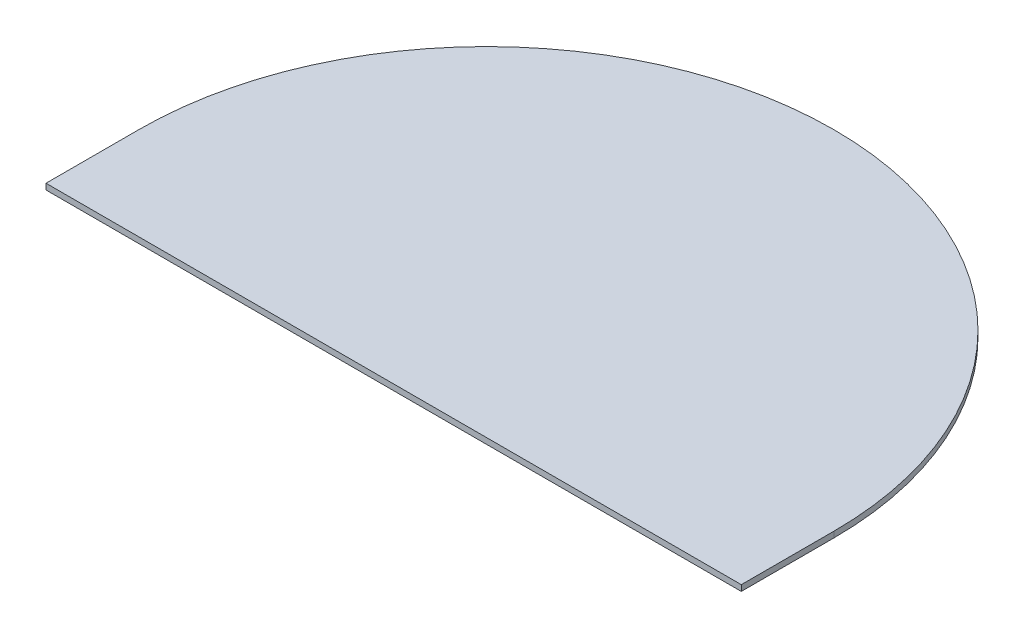
from build123d import *

# Parameters (mm, degrees)
BOSS_EXTRU_3_DEPTH = 6.35


with BuildPart() as part:
    # Esquisse2 → Boss.-Extru.3 (new body)
    with BuildSketch(Plane(origin=(0, 0, 0), x_dir=(1, 0, 0), z_dir=(0, 1, 0))):
        with BuildLine():
            Line((-375, -75), (375, -75))
            Line((375, -75), (375, 25))
            ThreePointArc((375, 25), (0, 400), (-375, 25))
            Line((-375, 25), (-375, -75))
        make_face()
    extrude(amount=BOSS_EXTRU_3_DEPTH)


solid = part.part
